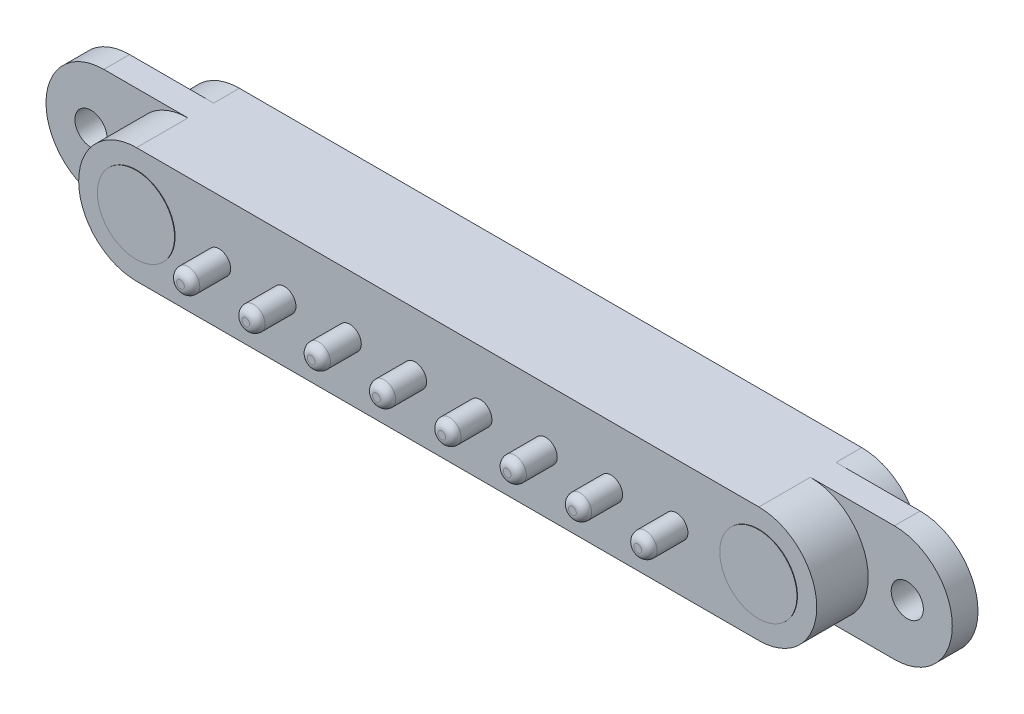
from build123d import *

# Parameters (mm, degrees)
EXTRUDE_1_DEPTH      = 4
EXTRUDE_START        = -2
SKETCH_2_3_R         = 0.625
EXTRUDE_2_DEPTH      = 1
EXTRUDE_3_DEPTH      = 1.5
EXTRUDE_3_DEPTH_BACK = 5.5
SKETCH_4_R           = 0.45
SKETCH_5_R           = 1.5
EXTRUDE_4_DEPTH      = 0.02
FILLET_1_R           = 0.3


with BuildPart() as part:
    # 草图2 → 凸台-拉伸1 (new body)
    with BuildSketch(Plane.XY):
        with BuildLine():
            Line((-12.1, 2.25), (12.1, 2.25))
            ThreePointArc((12.1, 2.25), (14.35, 0), (12.1, -2.25))
            Line((12.1, -2.25), (-12.1, -2.25))
            ThreePointArc((-12.1, -2.25), (-14.35, 0), (-12.1, 2.25))
        make_face()
    extrude(amount=-EXTRUDE_1_DEPTH)

    # 草图2<3> → 凸台-拉伸2 (add)
    with BuildSketch(Plane.XY.offset(EXTRUDE_START)):
        with BuildLine():
            Line((-15.37, 2.25), (15.37, 2.25))
            ThreePointArc((15.37, 2.25), (17.62, 0), (15.37, -2.25))
            Line((15.37, -2.25), (-15.37, -2.25))
            ThreePointArc((-15.37, -2.25), (-17.62, 0), (-15.37, 2.25))
        make_face()
        with Locations((-15.87, 0)):
            Circle(SKETCH_2_3_R, mode=Mode.SUBTRACT)
        with Locations((15.87, 0)):
            Circle(SKETCH_2_3_R, mode=Mode.SUBTRACT)
    extrude(amount=-EXTRUDE_2_DEPTH)

    # 草图4 → 凸台-拉伸3 (add, two sides: drawn at the far end of the back side and taken through both)
    with BuildSketch(Plane(origin=(0, 0, -4), x_dir=(-1, 0, 0), z_dir=(0, 0, -1)).offset(-EXTRUDE_3_DEPTH_BACK)):
        with Locations(Location((-8.89, 0, 0), (0, 0, 180))):
            Circle(SKETCH_4_R)
        with Locations(Location((-6.35, 0, 0), (0, 0, 180))):
            Circle(SKETCH_4_R)
        with Locations(Location((-3.81, 0, 0), (0, 0, 180))):
            Circle(SKETCH_4_R)
        with Locations(Location((-1.27, 0, 0), (0, 0, 180))):
            Circle(SKETCH_4_R)
        with Locations(Location((1.27, 0, 0), (0, 0, 180))):
            Circle(SKETCH_4_R)
        with Locations(Location((3.81, 0, 0), (0, 0, 180))):
            Circle(SKETCH_4_R)
        with Locations(Location((6.35, 0, 0), (0, 0, 180))):
            Circle(SKETCH_4_R)
        with Locations(Location((8.89, 0, 0), (0, 0, 180))):
            Circle(SKETCH_4_R)
    extrude(amount=EXTRUDE_3_DEPTH + EXTRUDE_3_DEPTH_BACK)

    # 草图5 → 凸台-拉伸4 (add)
    with BuildSketch(Plane.XY):
        with Locations(Location((-12.1, 0, 0), (0, 0, 180))):
            Circle(SKETCH_5_R)
        with Locations(Location((12.1, 0, 0), (0, 0, 180))):
            Circle(SKETCH_5_R)
    extrude(amount=EXTRUDE_4_DEPTH)

    # 圆角1
    fillet_1_edges = [part.edges().sort_by_distance(p)[0] for p in [
        (8.44, 0, 1.5),
        (5.9, 0, 1.5),
        (3.36, 0, 1.5),
        (0.82, 0, 1.5),
        (-1.72, 0, 1.5),
        (-4.26, 0, 1.5),
        (-6.8, 0, 1.5),
        (-9.34, 0, 1.5),
    ]]
    fillet(fillet_1_edges, radius=FILLET_1_R)


solid = part.part
